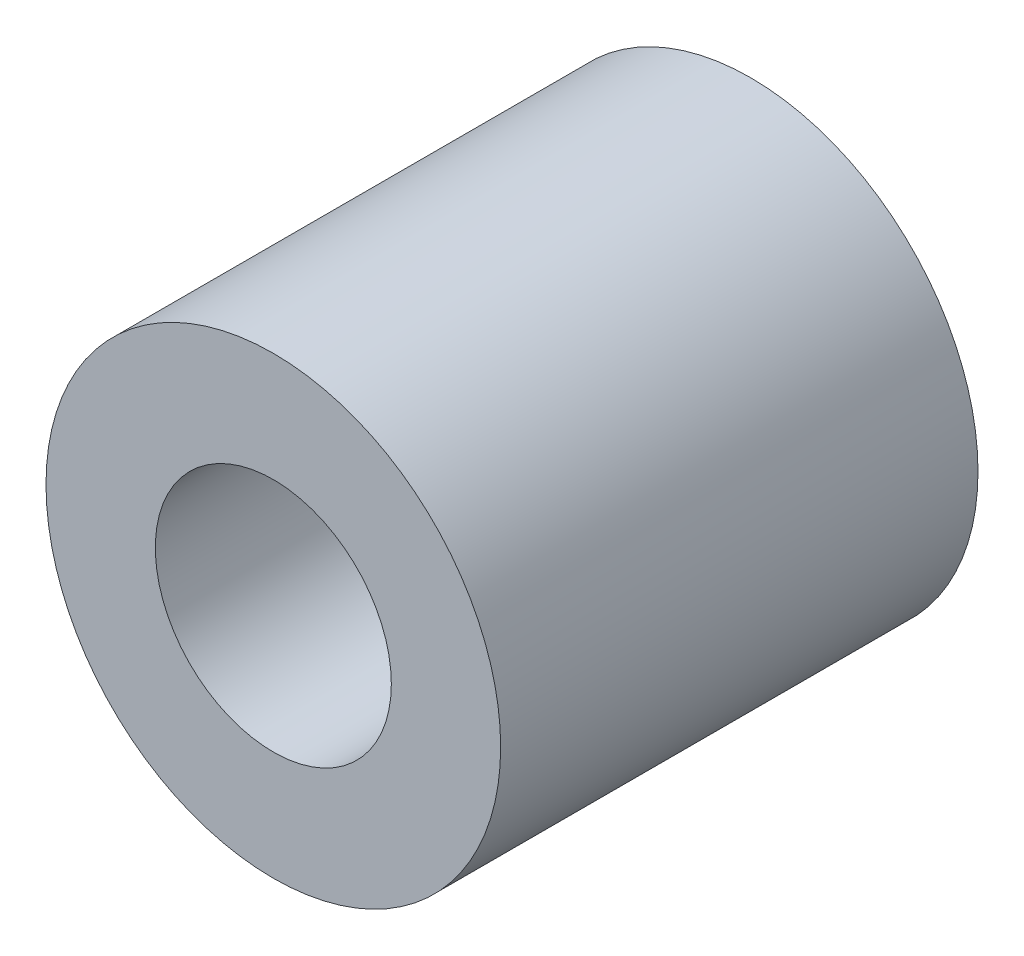
from build123d import *

# Parameters (mm, degrees)
SKETCH_1_R      = 47.623954512
SKETCH_1_R_2    = 24.723452768
EXTRUDE_1_DEPTH = 100


with BuildPart() as part:
    # 스케치1 → 보스-돌출1 (new body)
    with BuildSketch(Plane.XY):
        Circle(SKETCH_1_R)
        Circle(SKETCH_1_R_2, mode=Mode.SUBTRACT)
    extrude(amount=EXTRUDE_1_DEPTH)


solid = part.part
